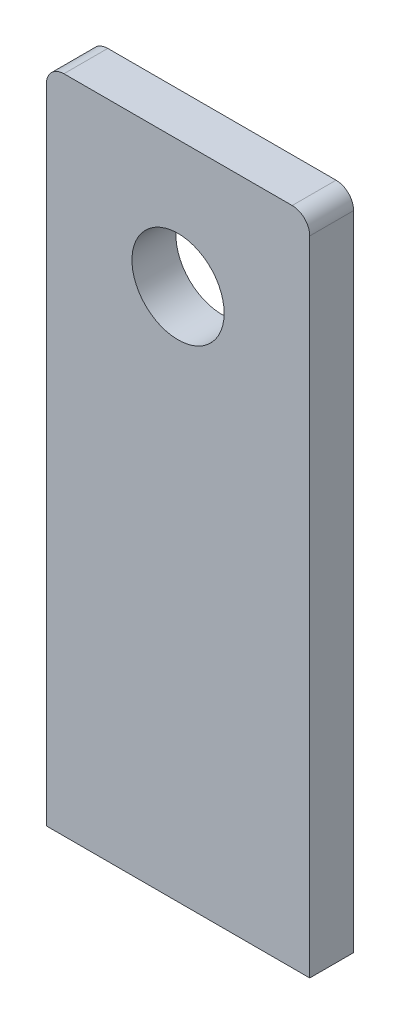
from build123d import *

# Parameters (mm, degrees)
SKETCH1_W           = 30
SKETCH1_H           = 75.2
SKETCH1_R           = 5.25
BOSS_EXTRUDE1_DEPTH = 2.5
FILLET1_R           = 2


with BuildPart() as part:
    # Sketch1 → Boss-Extrude1 (new, symmetric)
    with BuildSketch(Plane.XY):
        Rectangle(SKETCH1_W, SKETCH1_H)
        with Locations((0, 23.1)):
            Circle(SKETCH1_R, mode=Mode.SUBTRACT)
    extrude(amount=BOSS_EXTRUDE1_DEPTH, both=True)

    # Fillet1
    fillet1_edges = [part.edges().sort_by_distance(p)[0] for p in [
        (-15, 37.6, 0),
        (15, 37.6, 0),
    ]]
    fillet(fillet1_edges, radius=FILLET1_R)


solid = part.part
